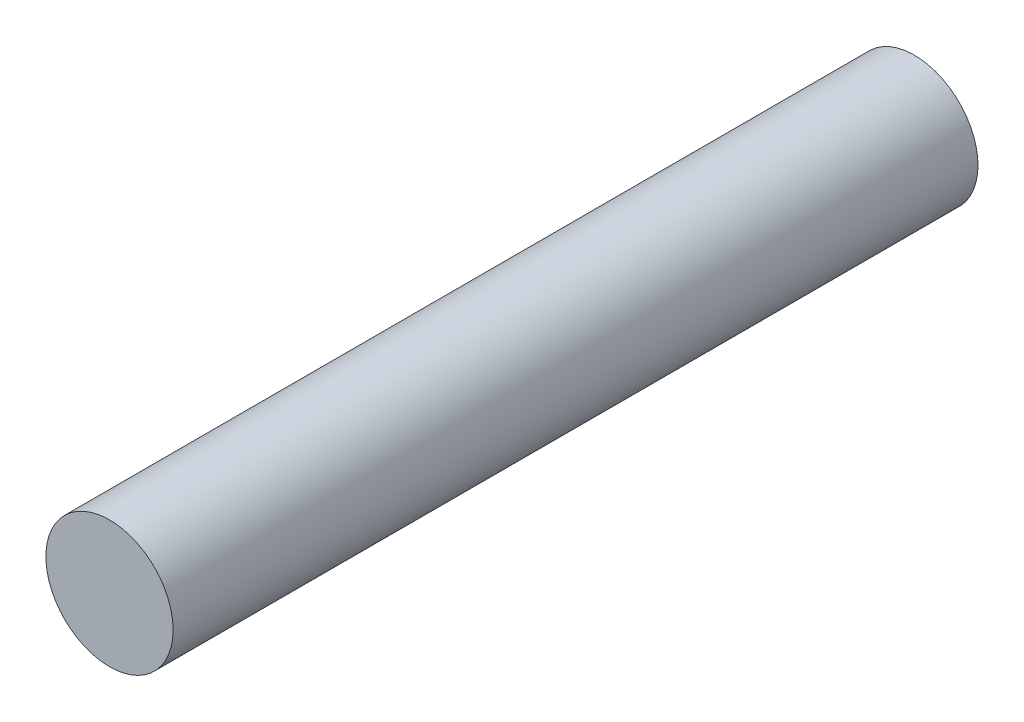
from build123d import *

# Parameters (mm, degrees)
SKETCH_1_R      = 2.45
EXTRUDE_1_DEPTH = 31


with BuildPart() as part:
    # 草图1 → 凸台-拉伸1 (new body)
    with BuildSketch(Plane.XY):
        Circle(SKETCH_1_R)
    extrude(amount=EXTRUDE_1_DEPTH)


solid = part.part
